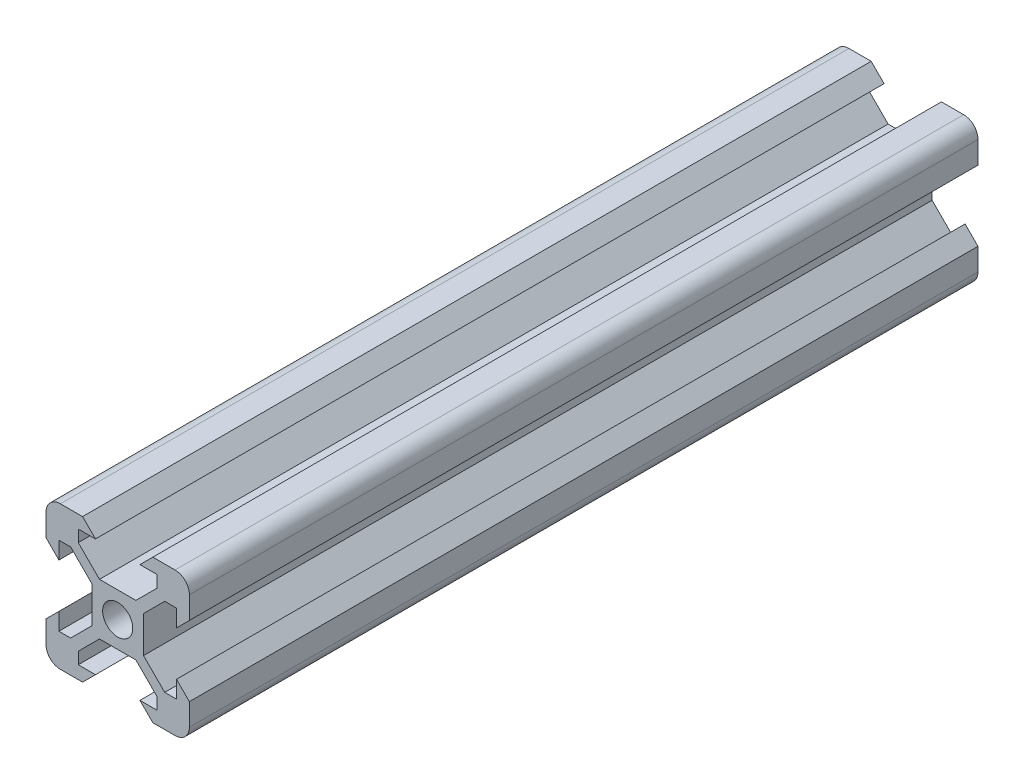
from build123d import *

# Parameters (mm, degrees)
SKETCH1_R           = 2.1
BOSS_EXTRUDE1_DEPTH = 110


with BuildPart() as part:
    # Sketch1 → Boss-Extrude1 (new body)
    with BuildSketch(Plane.XY):
        with BuildLine():
            Line((-4.9, -10), (-3.1, -8.2))
            Line((-3.1, -8.2), (-5.5, -8.2))
            Line((-5.5, -8.2), (-5.5, -6.560660172))
            Line((-5.5, -6.560660172), (-2.539339828, -3.6))
            Line((-2.539339828, -3.6), (2.539339828, -3.6))
            Line((2.539339828, -3.6), (5.5, -6.560660172))
            Line((5.5, -6.560660172), (5.5, -8.2))
            Line((5.5, -8.2), (3.1, -8.2))
            Line((3.1, -8.2), (4.9, -10))
            Line((4.9, -10), (8, -10))
            ThreePointArc((8, -10), (9.414213562, -9.414213562), (10, -8))
            Line((10, -8), (10, -4.9))
            Line((10, -4.9), (8.2, -3.1))
            Line((8.2, -3.1), (8.2, -5.5))
            Line((8.2, -5.5), (6.560660172, -5.5))
            Line((6.560660172, -5.5), (3.6, -2.539339828))
            Line((3.6, -2.539339828), (3.6, 2.539339828))
            Line((3.6, 2.539339828), (6.560660172, 5.5))
            Line((6.560660172, 5.5), (8.2, 5.5))
            Line((8.2, 5.5), (8.2, 3.1))
            Line((8.2, 3.1), (10, 4.9))
            Line((10, 4.9), (10, 8))
            ThreePointArc((10, 8), (9.414213562, 9.414213562), (8, 10))
            Line((8, 10), (4.9, 10))
            Line((4.9, 10), (3.1, 8.2))
            Line((3.1, 8.2), (5.5, 8.2))
            Line((5.5, 8.2), (5.5, 6.560660172))
            Line((5.5, 6.560660172), (2.539339828, 3.6))
            Line((2.539339828, 3.6), (-2.539339828, 3.6))
            Line((-2.539339828, 3.6), (-5.5, 6.560660172))
            Line((-5.5, 6.560660172), (-5.5, 8.2))
            Line((-5.5, 8.2), (-3.1, 8.2))
            Line((-3.1, 8.2), (-4.9, 10))
            Line((-4.9, 10), (-8, 10))
            ThreePointArc((-8, 10), (-9.414213562, 9.414213562), (-10, 8))
            Line((-10, 8), (-10, 4.9))
            Line((-10, 4.9), (-8.2, 3.1))
            Line((-8.2, 3.1), (-8.2, 5.5))
            Line((-8.2, 5.5), (-6.560660172, 5.5))
            Line((-6.560660172, 5.5), (-3.6, 2.539339828))
            Line((-3.6, 2.539339828), (-3.6, -2.539339828))
            Line((-3.6, -2.539339828), (-6.560660172, -5.5))
            Line((-6.560660172, -5.5), (-8.2, -5.5))
            Line((-8.2, -5.5), (-8.2, -3.1))
            Line((-8.2, -3.1), (-10, -4.9))
            Line((-10, -4.9), (-10, -8))
            ThreePointArc((-10, -8), (-9.414213562, -9.414213562), (-8, -10))
            Line((-8, -10), (-4.9, -10))
        make_face()
        Circle(SKETCH1_R, mode=Mode.SUBTRACT)
    extrude(amount=BOSS_EXTRUDE1_DEPTH)


solid = part.part
